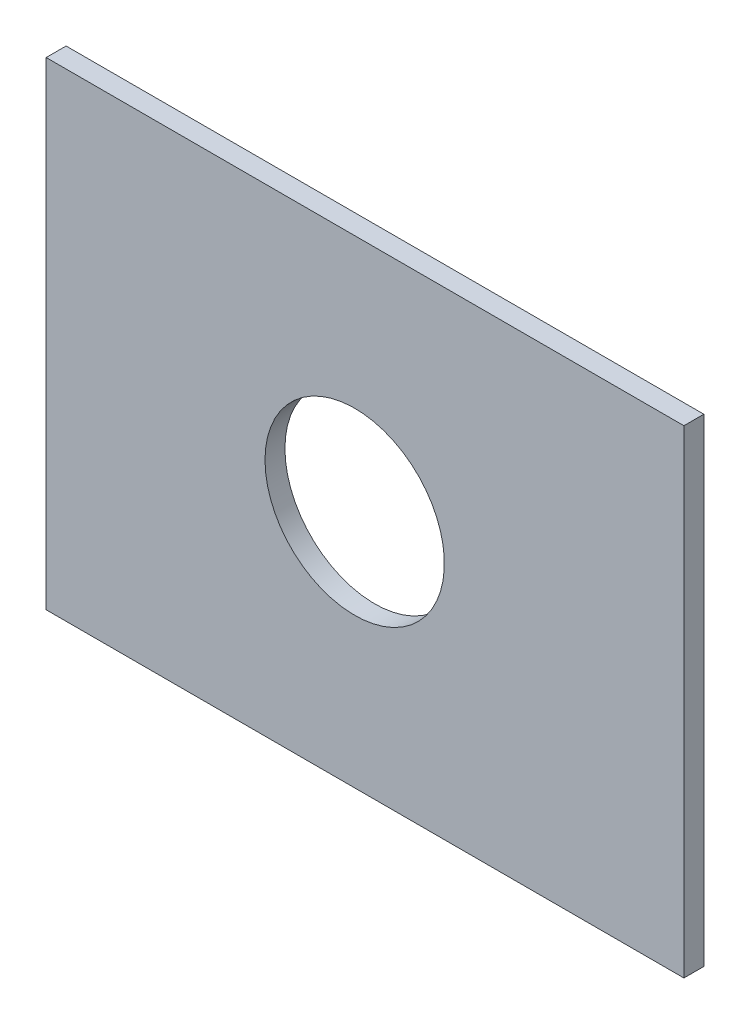
from build123d import *

# Parameters (mm, degrees)
SKETCH4_W           = 101.6
SKETCH4_H           = 76.2
SKETCH4_R           = 14.2875
BOSS_EXTRUDE1_DEPTH = 3.175


with BuildPart() as part:
    # Sketch4 → Boss-Extrude1 (new body)
    with BuildSketch(Plane(origin=(0, 0, -1436.319329267), x_dir=(-1, 0, 0), z_dir=(0, 0, -1))):
        with Locations((2219.515150098, 185.98908075)):
            Rectangle(SKETCH4_W, SKETCH4_H)
        with Locations((2221.165130355, 185.98908075)):
            Circle(SKETCH4_R, mode=Mode.SUBTRACT)
    extrude(amount=BOSS_EXTRUDE1_DEPTH)


solid = part.part
